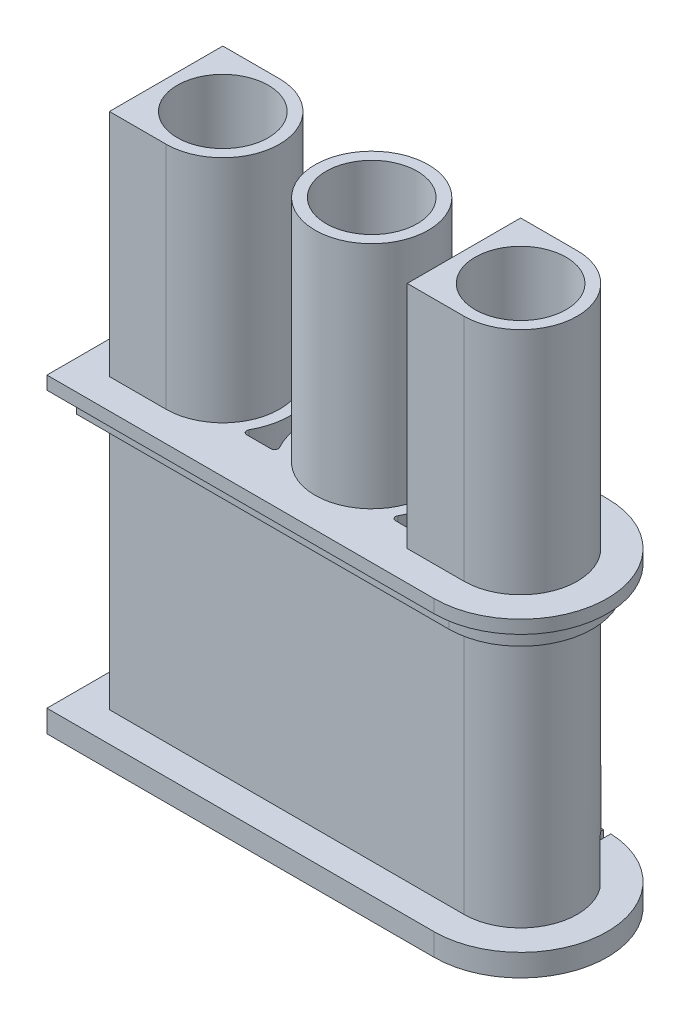
from build123d import *

# Parameters (mm, degrees)
SKETCH1_R               = 3.83
SKETCH1_R_2             = 3.075
BOSS_EXTRUDE1_DEPTH     = 36.5
BOSS_EXTRUDE1_2_DEPTH   = 36.5
BOSS_EXTRUDE1_3_DEPTH   = 36.5
SKETCH2_R               = 3.075
BOSS_EXTRUDE2_DEPTH     = 1.5
SKETCH3_R               = 3.075
BOSS_EXTRUDE3_DEPTH     = 17.2
SKETCH4_R               = 3.075
BOSS_EXTRUDE4_DEPTH     = 2.29
CUT_EXTRUDE1_DEPTH      = 1.4
FILLET1_R               = 0.25
CUT_EXTRUDE_THIN2_DEPTH = 1.6
SKETCH7_W               = 6.15
SKETCH7_H               = 8.738173166
SKETCH7_H_2             = 8.358950775
CUT_EXTRUDE2_DEPTH      = 3


with BuildPart() as part:
    # Sketch1 → Boss-Extrude1 (new body)
    with BuildSketch(Plane(origin=(0, 0, 0), x_dir=(1, 0, 0), z_dir=(0, 1, 0))):
        with Locations(Location((0, 0, 0), (0, 0, 270))):
            Circle(SKETCH1_R)
        with Locations(Location((0, 0, 0), (0, 0, 270))):
            Circle(SKETCH1_R_2, mode=Mode.SUBTRACT)
    extrude(amount=BOSS_EXTRUDE1_DEPTH)



with BuildPart() as body_2:
    # Sketch1 → Boss-Extrude1 2 (new body)
    with BuildSketch(Plane(origin=(0, 0, 0), x_dir=(1, 0, 0), z_dir=(0, 1, 0))):
        with BuildLine():
            Line((-10.06, 3.83), (-13.89, 3.83))
            Line((-13.89, 3.83), (-13.89, -3.83))
            Line((-13.89, -3.83), (-10.06, -3.83))
            ThreePointArc((-10.06, -3.83), (-6.23, 0), (-10.06, 3.83))
        make_face()
        with Locations(Location((-10.06, 0, 0), (0, 0, 270))):
            Circle(SKETCH1_R_2, mode=Mode.SUBTRACT)
    extrude(amount=BOSS_EXTRUDE1_2_DEPTH)


with BuildPart() as body_3:
    # Sketch1 → Boss-Extrude1 3 (new body)
    with BuildSketch(Plane(origin=(0, 0, 0), x_dir=(1, 0, 0), z_dir=(0, 1, 0))):
        with BuildLine():
            Line((10.06, 3.83), (6.23, 3.83))
            Line((6.23, 3.83), (6.23, -3.83))
            Line((6.23, -3.83), (10.06, -3.83))
            ThreePointArc((10.06, -3.83), (13.89, 0), (10.06, 3.83))
        make_face()
        with Locations(Location((10.06, 0, 0), (0, 0, 270))):
            Circle(SKETCH1_R_2, mode=Mode.SUBTRACT)
    extrude(amount=BOSS_EXTRUDE1_3_DEPTH)


with BuildPart() as part_1:
    add(part.part)

    add(body_2.part)  # Boss-Extrude2 merges body 2

    add(body_3.part)  # Boss-Extrude2 merges body 3
    # Sketch2 → Boss-Extrude2 (add)
    with BuildSketch(Plane(origin=(0, 0, 0), x_dir=(1, 0, 0), z_dir=(0, 1, 0))):
        with BuildLine():
            Line((-10.06, 5.85), (10.06, 5.85))
            ThreePointArc((10.06, 5.85), (15.91, 0), (10.06, -5.85))
            Line((10.06, -5.85), (-10.06, -5.85))
            Line((-10.06, -5.85), (-16.09, -5.85))
            Line((-16.09, -5.85), (-16.09, 5.85))
            Line((-16.09, 5.85), (-10.06, 5.85))
        make_face()
        with Locations(Location((-10.06, 0, 0), (0, 0, 270))):
            Circle(SKETCH2_R, mode=Mode.SUBTRACT)
        with Locations(Location((0, 0, 0), (0, 0, 270))):
            Circle(SKETCH2_R, mode=Mode.SUBTRACT)
        with Locations(Location((10.06, 0, 0), (0, 0, 270))):
            Circle(SKETCH2_R, mode=Mode.SUBTRACT)
        with BuildLine():
            Line((5.485, -2.6), (5.485, 2.6))
            Line((5.485, 2.6), (3.764389061, 2.6))
            ThreePointArc((3.764389061, 2.6), (4.575, 0), (3.764389061, -2.6))
            Line((3.764389061, -2.6), (5.485, -2.6))
        make_face(mode=Mode.SUBTRACT)
        with BuildLine():
            Line((-3.764389061, 2.6), (-6.295610939, 2.6))
            ThreePointArc((-6.295610939, 2.6), (-5.485, 0), (-6.295610939, -2.6))
            Line((-6.295610939, -2.6), (-3.764389061, -2.6))
            ThreePointArc((-3.764389061, -2.6), (-4.575, 0), (-3.764389061, 2.6))
        make_face(mode=Mode.SUBTRACT)
    extrude(amount=BOSS_EXTRUDE2_DEPTH)

    # Sketch3 → Boss-Extrude3 (add)
    with BuildSketch(Plane(origin=(0, 1.5, 0), x_dir=(1, 0, 0), z_dir=(0, 1, 0))):
        with BuildLine():
            Line((-1.387862692, -3.83), (-13.89, -3.83))
            Line((-13.89, -3.83), (-13.89, 3.83))
            Line((-13.89, 3.83), (-3.321031177, 3.83))
            Line((-3.321031177, 3.83), (10.06, 3.83))
            ThreePointArc((10.06, 3.83), (13.89, 0), (10.06, -3.83))
            Line((10.06, -3.83), (-1.387862692, -3.83))
        make_face()
        with Locations(Location((-10.06, 0, 0), (0, 0, 270))):
            Circle(SKETCH3_R, mode=Mode.SUBTRACT)
        with Locations(Location((0, 0, 0), (0, 0, 270))):
            Circle(SKETCH3_R, mode=Mode.SUBTRACT)
        with Locations(Location((10.06, 0, 0), (0, 0, 270))):
            Circle(SKETCH3_R, mode=Mode.SUBTRACT)
        with BuildLine():
            Line((-3.764389061, 2.6), (-6.295610939, 2.6))
            ThreePointArc((-6.295610939, 2.6), (-5.485, 0), (-6.295610939, -2.6))
            Line((-6.295610939, -2.6), (-3.764389061, -2.6))
            ThreePointArc((-3.764389061, -2.6), (-4.575, 0), (-3.764389061, 2.6))
        make_face(mode=Mode.SUBTRACT)
        with BuildLine():
            Line((5.485, -2.6), (5.485, 2.6))
            Line((5.485, 2.6), (3.764389061, 2.6))
            ThreePointArc((3.764389061, 2.6), (4.575, 0), (3.764389061, -2.6))
            Line((3.764389061, -2.6), (5.485, -2.6))
        make_face(mode=Mode.SUBTRACT)
    extrude(amount=BOSS_EXTRUDE3_DEPTH)

    # Sketch4 → Boss-Extrude4 (add)
    with BuildSketch(Plane(origin=(0, 18.7, 0), x_dir=(1, 0, 0), z_dir=(0, 1, 0))):
        with BuildLine():
            Line((10.06, 5.85), (-10.06, 5.85))
            Line((-10.06, 5.85), (-16.09, 5.85))
            Line((-16.09, 5.85), (-16.09, -5.85))
            Line((-16.09, -5.85), (-10.06, -5.85))
            Line((-10.06, -5.85), (10.06, -5.85))
            ThreePointArc((10.06, -5.85), (15.91, 0), (10.06, 5.85))
        make_face()
        with Locations(Location((-10.06, 0, 0), (0, 0, 270))):
            Circle(SKETCH4_R, mode=Mode.SUBTRACT)
        with Locations(Location((10.06, 0, 0), (0, 0, 270))):
            Circle(SKETCH4_R, mode=Mode.SUBTRACT)
        with Locations(Location((0, 0, 0), (0, 0, 270))):
            Circle(SKETCH4_R, mode=Mode.SUBTRACT)
        with BuildLine():
            Line((-3.764389061, 2.6), (-6.295610939, 2.6))
            ThreePointArc((-6.295610939, 2.6), (-5.485, 0), (-6.295610939, -2.6))
            Line((-6.295610939, -2.6), (-3.764389061, -2.6))
            ThreePointArc((-3.764389061, -2.6), (-4.575, 0), (-3.764389061, 2.6))
        make_face(mode=Mode.SUBTRACT)
        with BuildLine():
            Line((5.485, -2.6), (5.485, 2.6))
            Line((5.485, 2.6), (3.764389061, 2.6))
            ThreePointArc((3.764389061, 2.6), (4.575, 0), (3.764389061, -2.6))
            Line((3.764389061, -2.6), (5.485, -2.6))
        make_face(mode=Mode.SUBTRACT)
    extrude(amount=BOSS_EXTRUDE4_DEPTH)

    # Sketch5 → Cut-Extrude1 (cut)
    with BuildSketch(Plane.XZ.offset(-18.7)):
        with BuildLine():
            Line((-16.09, 5.85), (10.06, 5.85))
            ThreePointArc((10.06, 5.85), (15.91, 0), (10.06, -5.85))
            Line((10.06, -5.85), (-16.09, -5.85))
            Line((-16.09, -5.85), (-16.09, 5.85))
        make_face()
        with BuildLine():
            Line((-15.09, 4.85), (10.06, 4.85))
            ThreePointArc((10.06, 4.85), (14.91, 0), (10.06, -4.85))
            Line((10.06, -4.85), (-15.09, -4.85))
            Line((-15.09, -4.85), (-15.09, 4.85))
        make_face(mode=Mode.SUBTRACT)
    extrude(amount=-CUT_EXTRUDE1_DEPTH, mode=Mode.SUBTRACT)

    # Fillet1
    fillet1_edges = [part_1.edges().sort_by_distance(p)[0] for p in [
        (-3.764389061, 10.495, -2.6),
        (-6.295610939, 10.495, -2.6),
        (-6.295610939, 10.495, 2.6),
        (-3.764389061, 10.495, 2.6),
        (5.485, 10.495, 2.6),
        (5.485, 10.495, -2.6),
        (3.764389061, 10.495, -2.6),
        (3.764389061, 10.495, 2.6),
    ]]
    fillet(fillet1_edges, radius=FILLET1_R)

    # Sketch6 → Cut-Extrude-Thin2 (cut)
    with BuildSketch(Plane.XZ):
        Polygon((-10.31, 0), (-10.31, -6.991466743), (10.31, -7.436536546), (10.31, 0), (9.81, 0), (9.81, -6.925627901), (-9.81, -6.502142473), (-9.81, 0), align=None)
    extrude(amount=-CUT_EXTRUDE_THIN2_DEPTH, mode=Mode.SUBTRACT)

    # Sketch7 → Cut-Extrude2 (cut)
    with BuildSketch(Plane(origin=(0, 1.5, 0), x_dir=(1, 0, 0), z_dir=(0, 1, 0))):
        with Locations((-10.06, 4.369086583)):
            Rectangle(SKETCH7_W, SKETCH7_H)
        with Locations((10.06, 4.179475388)):
            Rectangle(SKETCH7_W, SKETCH7_H_2)
    extrude(amount=CUT_EXTRUDE2_DEPTH, mode=Mode.SUBTRACT)


solid = part_1.part
